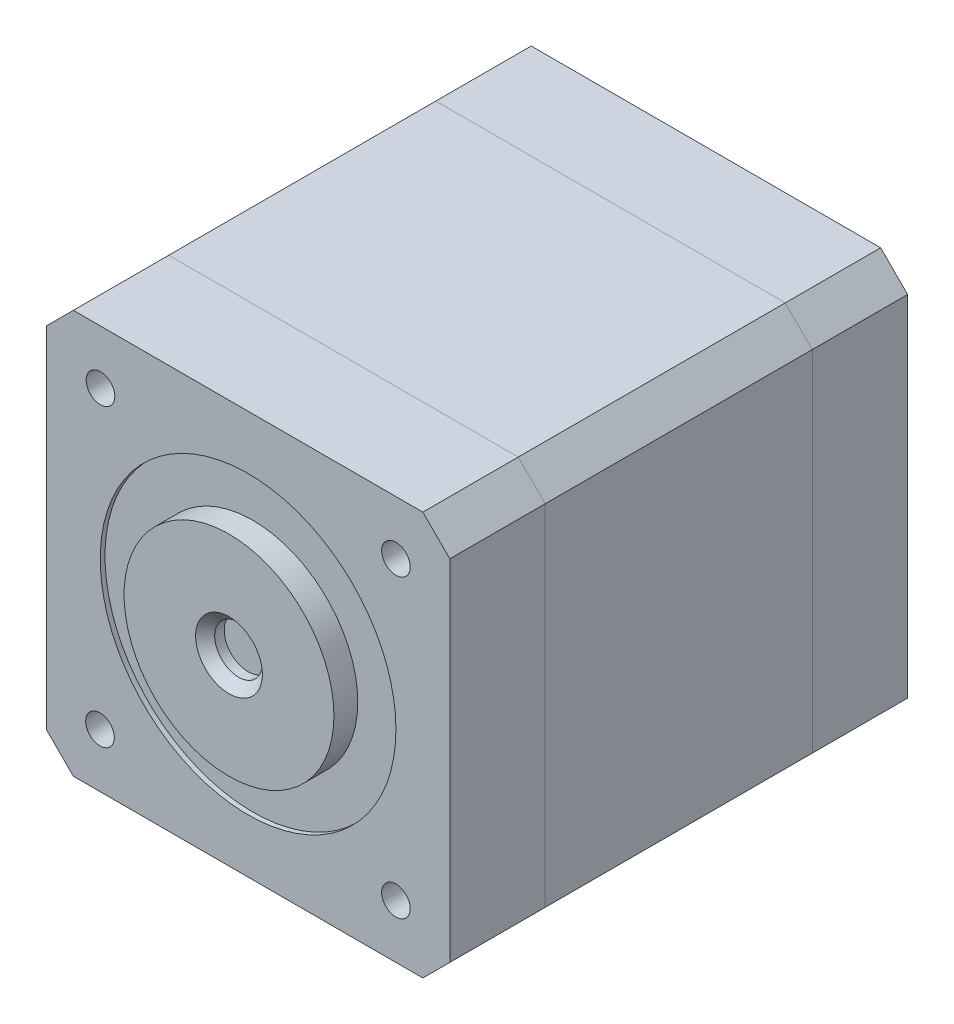
from build123d import *

# Parameters (mm, degrees)
EXTRUDE_1_DEPTH     = 10
EXTRUDE_2_DEPTH     = 28
EXTRUDE_3_DEPTH     = 10
SKETCH_1_3_R        = 15.5
SKETCH_1_3_R_2      = 11
CUT_EXTRUDE_1_DEPTH = 0.5
EXTRUDE_START       = 2
SKETCH_1_4_R        = 11
SKETCH_1_4_R_2      = 2.5
EXTRUDE_4_DEPTH     = 2
CHAMFER_1_SIZE      = 1
SKETCH_5_R          = 1.5
CUT_EXTRUDE_3_DEPTH = 3


with BuildPart() as part:
    # 草图1 → 凸台-拉伸1 (new body)
    with BuildSketch(Plane.XY):
        Polygon((21.15, 18.321572875), (18.321572875, 21.15), (-18.321572875, 21.15), (-21.15, 18.321572875), (-21.15, -18.321572875), (-18.321572875, -21.15), (18.321572875, -21.15), (21.15, -18.321572875), align=None)
    extrude(amount=-EXTRUDE_1_DEPTH)

    # 草图1<3> → 切除-拉伸1 (cut)
    with BuildSketch(Plane.XY):
        Circle(SKETCH_1_3_R)
        Circle(SKETCH_1_3_R_2, mode=Mode.SUBTRACT)
    extrude(amount=-CUT_EXTRUDE_1_DEPTH, mode=Mode.SUBTRACT)

    # 草图1<4> → 凸台-拉伸4 (add)
    with BuildSketch(Plane.XY.offset(EXTRUDE_START)):
        Circle(SKETCH_1_4_R)
        Circle(SKETCH_1_4_R_2, mode=Mode.SUBTRACT)
    extrude(amount=-EXTRUDE_4_DEPTH)

    # 倒角1
    chamfer_1_edges = [part.edges().sort_by_distance(p)[0] for p in [
        (-2.5, 0, 2),
    ]]
    chamfer(chamfer_1_edges, length=CHAMFER_1_SIZE)

    # 草图5 → 切除-拉伸3 (cut)
    with BuildSketch(Plane.XY):
        with Locations((-15.473447232, 15.499954591)):
            Circle(SKETCH_5_R)
        with Locations((15.5, 15.5)):
            Circle(SKETCH_5_R)
        with Locations((15.5, -15.526507359)):
            Circle(SKETCH_5_R)
        with Locations((-15.526507359, -15.5)):
            Circle(SKETCH_5_R)
    extrude(amount=-CUT_EXTRUDE_3_DEPTH, mode=Mode.SUBTRACT)


with BuildPart() as body_2:
    # 草图2 → 凸台-拉伸2 (new body)
    with BuildSketch(Plane(origin=(0, 0, -10), x_dir=(-1, 0, 0), z_dir=(0, 0, -1))):
        Polygon((-21.15, 18.321572875), (-21.15, -18.321572875), (-18.321572875, -21.15), (18.321572875, -21.15), (21.15, -18.321572875), (21.15, 18.321572875), (18.321572875, 21.15), (-18.321572875, 21.15), align=None)
    extrude(amount=EXTRUDE_2_DEPTH)


with BuildPart() as body_3:
    # 草图3 → 凸台-拉伸3 (new body)
    with BuildSketch(Plane(origin=(0, 0, -38), x_dir=(-1, 0, 0), z_dir=(0, 0, -1))):
        Polygon((-18.321572875, 21.15), (-21.15, 18.321572875), (-21.15, -18.321572875), (-18.321572875, -21.15), (18.321572875, -21.15), (21.15, -18.321572875), (21.15, 18.321572875), (18.321572875, 21.15), align=None)
    extrude(amount=EXTRUDE_3_DEPTH)


solid = Compound([part.part, body_2.part, body_3.part])
